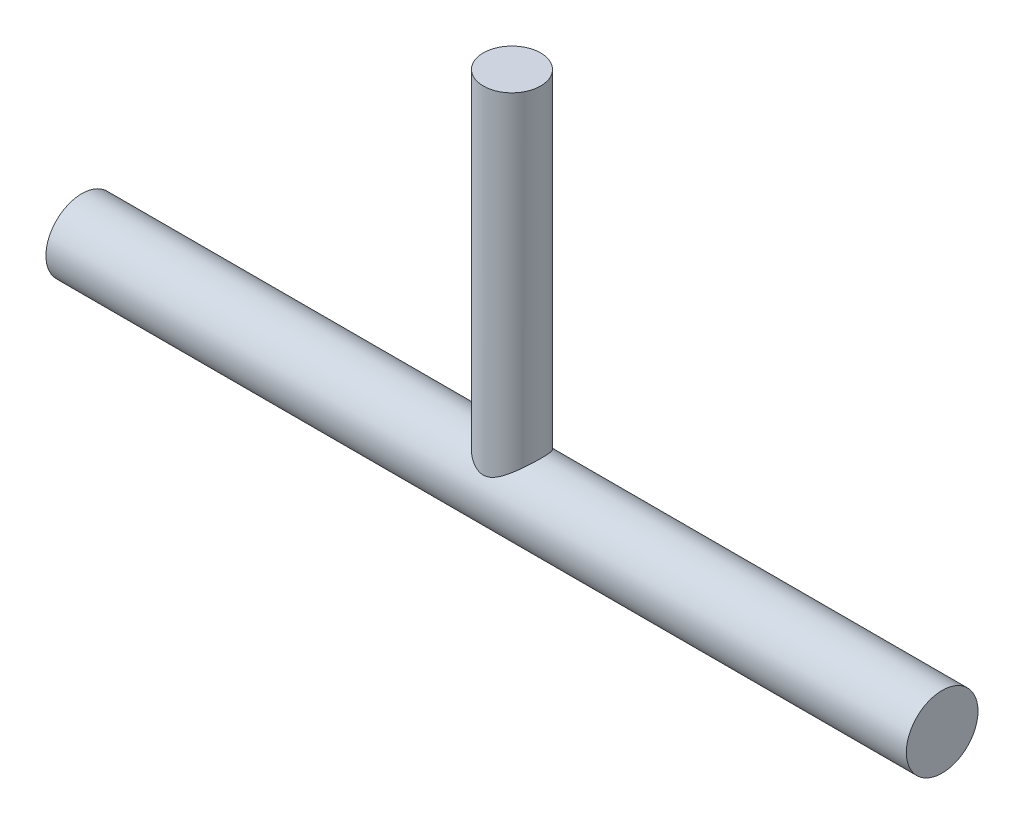
from build123d import *

# Parameters (mm, degrees)
SKETCH_1_R      = 5
EXTRUDE_1_DEPTH = 60
SKETCH_2_R      = 4
EXTRUDE_2_DEPTH = 50


with BuildPart() as part:
    # 草图1 → 凸台-拉伸1 (new, symmetric)
    with BuildSketch(Plane(origin=(0, 0, 0), x_dir=(0, 0, -1), z_dir=(1, 0, 0))):
        Circle(SKETCH_1_R)
    extrude(amount=EXTRUDE_1_DEPTH, both=True)

    # 草图2 → 凸台-拉伸2 (add)
    with BuildSketch(Plane(origin=(0, 0, 0), x_dir=(1, 0, 0), z_dir=(0, 1, 0))):
        with Locations(Location((0, 0, 0), (0, 0, 90))):
            Circle(SKETCH_2_R)
    extrude(amount=EXTRUDE_2_DEPTH)


with BuildPart() as part_1:
    # Move Body 1: moved
    add(part.part.moved(Location((60, 0, 0))))


solid = part_1.part
